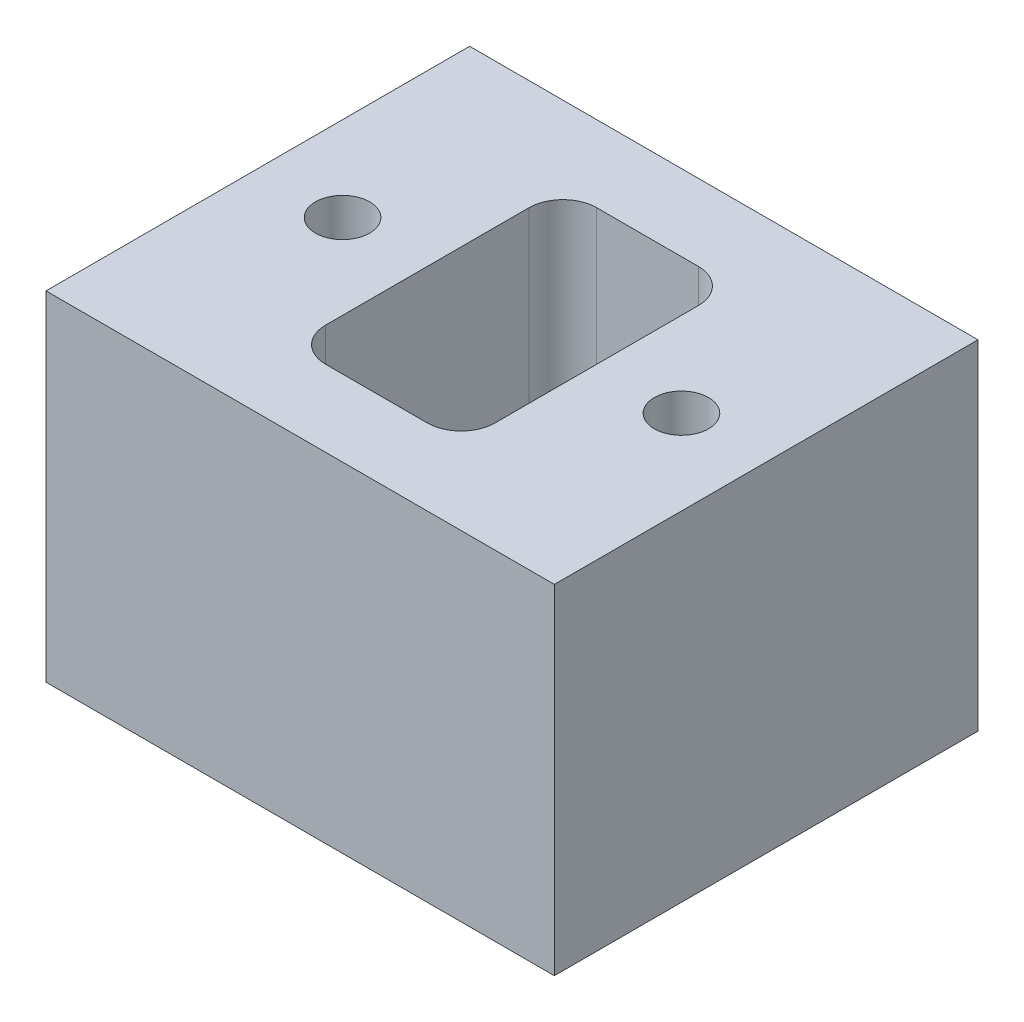
from build123d import *

# Parameters (mm, degrees)
SKETCH_1_W          = 30
SKETCH_1_H          = 25
SKETCH_1_R          = 1.6
EXTRUDE_1_DEPTH     = 20
CUT_EXTRUDE_1_DEPTH = 20


with BuildPart() as part:
    # 草图1 → 凸台-拉伸1 (new body)
    with BuildSketch(Plane(origin=(0, 0, 0), x_dir=(1, 0, 0), z_dir=(0, 1, 0))):
        Rectangle(SKETCH_1_W, SKETCH_1_H)
        with Locations(Location((-10, 0, 0), (0, 0, 270))):
            Circle(SKETCH_1_R, mode=Mode.SUBTRACT)
        with Locations(Location((10, 0, 0), (0, 0, 270))):
            Circle(SKETCH_1_R, mode=Mode.SUBTRACT)
    extrude(amount=EXTRUDE_1_DEPTH)

    # 草图2 → 切除-拉伸1 (cut)
    with BuildSketch(Plane(origin=(0, 20, 0), x_dir=(1, 0, 0), z_dir=(0, 1, 0))):
        with BuildLine():
            Line((-3, -8), (3, -8))
            ThreePointArc((3, -8), (4.414213562, -7.414213562), (5, -6))
            Line((5, -6), (5, 6))
            ThreePointArc((5, 6), (4.414213562, 7.414213562), (3, 8))
            Line((3, 8), (-3, 8))
            ThreePointArc((-3, 8), (-4.414213562, 7.414213562), (-5, 6))
            Line((-5, 6), (-5, -6))
            ThreePointArc((-5, -6), (-4.414213562, -7.414213562), (-3, -8))
        make_face()
    extrude(amount=-CUT_EXTRUDE_1_DEPTH, mode=Mode.SUBTRACT)


solid = part.part
